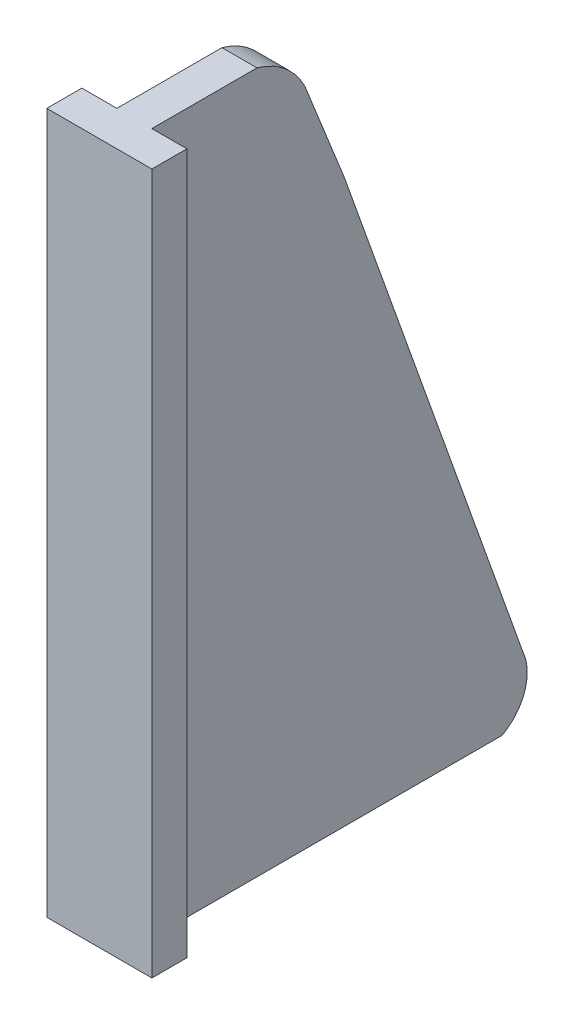
from build123d import *

# Parameters (mm, degrees)
RESSALTO_EXTRUS_O1_DEPTH = 30
ESBO_O7_W                = 124.831233659
ESBO_O7_H                = 205.409079033
CORTE_EXTRUS_O1_DEPTH    = 26
ESBO_O9_W                = 108.1037386
ESBO_O9_H                = 206.486977543
CORTE_EXTRUS_O2_DEPTH    = 72


with BuildPart() as part:
    # Esboço1 → Ressalto-extrusão1 (new body)
    with BuildSketch(Plane(origin=(0, 0, 0), x_dir=(0, 0, -1), z_dir=(1, 0, 0))):
        with BuildLine():
            Line((0, 0), (0, 200))
            Line((0, 200), (40.020408359, 200))
            ThreePointArc((40.020408359, 200), (48.108078735, 195.725277713), (53.718695877, 188.5))
            Line((53.718695877, 188.5), (64.817635807, 160.769350553))
            Line((64.817635807, 160.769350553), (115.921293578, 17.653015861))
            ThreePointArc((115.921293578, 17.653015861), (116.438632656, 7.659898466), (110, 0))
            Line((110, 0), (0, 0))
        make_face()
    extrude(amount=RESSALTO_EXTRUS_O1_DEPTH)

    # Esboço7 → Corte-extrusão1 (cut)
    with BuildSketch(Plane(origin=(20, 0, 0), x_dir=(0, 0, -1), z_dir=(1, 0, 0))):
        with Locations((72.41561683, 101.939412441)):
            Rectangle(ESBO_O7_W, ESBO_O7_H)
    extrude(amount=CORTE_EXTRUS_O1_DEPTH, mode=Mode.SUBTRACT)

    # Esboço9 → Corte-extrusão2 (cut)
    with BuildSketch(Plane.ZY.offset(-10)):
        with Locations((-64.0518693, 99.930966914)):
            Rectangle(ESBO_O9_W, ESBO_O9_H)
    extrude(amount=CORTE_EXTRUS_O2_DEPTH, mode=Mode.SUBTRACT)


solid = part.part
